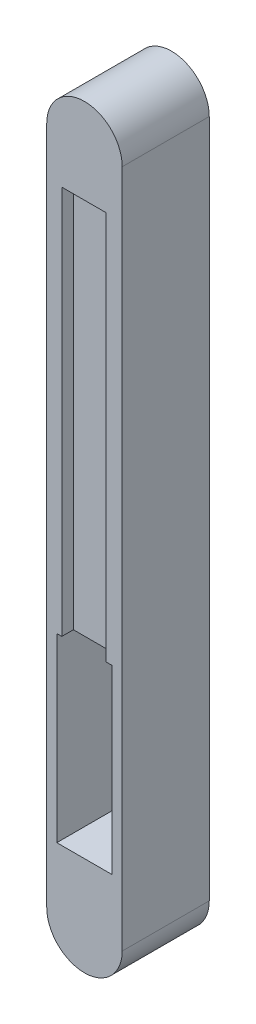
from build123d import *

# Parameters (mm, degrees)
BOSS_EXTRUDE1_DEPTH = 135
SKETCH3_R           = 3.5
CUT_EXTRUDE2_DEPTH  = 10
SKETCH6_W           = 11
SKETCH6_H           = 36
CUT_EXTRUDE3_DEPTH  = 40
SKETCH7_W           = 55
SKETCH7_H           = 16.435142828
BOSS_EXTRUDE2_DEPTH = 35
CUT_EXTRUDE4_DEPTH  = 20
CUT_EXTRUDE5_DEPTH  = 20
SKETCH12_R          = 4.5
CUT_EXTRUDE6_DEPTH  = 20
CUT_EXTRUDE7_DEPTH  = 120
SKETCH14_W          = 10
SKETCH14_H          = 112.990035736
BOSS_EXTRUDE3_DEPTH = 9
SKETCH16_W          = 117.700647477
SKETCH16_H          = 151.246123551
CUT_EXTRUDE11_DEPTH = 166.309899973


with BuildPart() as part:
    # Sketch2 → Boss-Extrude1 (new body)
    with BuildSketch(Plane.XY):
        with BuildLine():
            Line((-7.403081865, 56.261800555), (-7.403081865, -78.738199445))
            ThreePointArc((-7.403081865, -78.738199445), (0.096918135, -86.238199445), (7.596918135, -78.738199445))
            Line((7.596918135, -78.738199445), (7.596918135, 56.261800555))
            ThreePointArc((7.596918135, 56.261800555), (0.096918135, 63.761800555), (-7.403081865, 56.261800555))
        make_face()
    extrude(amount=BOSS_EXTRUDE1_DEPTH)

    # Sketch3 → Cut-Extrude2 (cut)
    with BuildSketch(Plane(origin=(0, 0, 0), x_dir=(-1, 0, 0), z_dir=(0, 0, -1))):
        with Locations((-0.096918135, 54.761800555)):
            Circle(SKETCH3_R)
    extrude(amount=-CUT_EXTRUDE2_DEPTH, mode=Mode.SUBTRACT)

    # Sketch6 → Cut-Extrude3 (cut)
    with BuildSketch(Plane(origin=(0, 0, 0), x_dir=(-1, 0, 0), z_dir=(0, 0, -1))):
        with Locations((-0.096918135, -48.578199445)):
            Rectangle(SKETCH6_W, SKETCH6_H)
    extrude(amount=-CUT_EXTRUDE3_DEPTH, mode=Mode.SUBTRACT)

    # Sketch7 → Boss-Extrude2 (add)
    with BuildSketch(Plane.ZY.offset(7.403081865)):
        with Locations((67.5, -49.750557846)):
            Rectangle(SKETCH7_W, SKETCH7_H)
    extrude(amount=BOSS_EXTRUDE2_DEPTH)

    # Sketch10 → Cut-Extrude4 (cut)
    with BuildSketch(Plane(origin=(0, -41.532986432, 0), x_dir=(1, 0, 0), z_dir=(0, 1, 0))):
        with BuildLine():
            Line((-7.403081865, -40), (-42.403081865, -40))
            Line((-42.403081865, -40), (-42.403081865, -95))
            Line((-42.403081865, -95), (-7.403081865, -95))
            ThreePointArc((-7.403081865, -95), (-33.21161021, -67.5), (-7.403081865, -40))
        make_face()
    extrude(amount=-CUT_EXTRUDE4_DEPTH, mode=Mode.SUBTRACT)

    # Sketch11 → Cut-Extrude5 (cut)
    with BuildSketch(Plane(origin=(0, -41.532986432, 0), x_dir=(1, 0, 0), z_dir=(0, 1, 0))):
        with BuildLine():
            Line((-7.569996139, -52.041059143), (-7.569996139, -82.958940857))
            ThreePointArc((-7.569996139, -82.958940857), (-23.028936996, -67.5), (-7.569996139, -52.041059143))
        make_face()
    extrude(amount=-CUT_EXTRUDE5_DEPTH, mode=Mode.SUBTRACT)

    # Sketch12 → Cut-Extrude6 (cut)
    with BuildSketch(Plane.XY.offset(135)):
        with Locations((0.096918135, 54.761800555)):
            Circle(SKETCH12_R)
    extrude(amount=-CUT_EXTRUDE6_DEPTH, mode=Mode.SUBTRACT)

    # Sketch13 → Cut-Extrude7 (cut)
    with BuildSketch(Plane.XY.offset(135)):
        Polygon((4.403081865, 46.751836291), (-4.403081865, 46.751836291), (-4.403081865, -46.751836291), (-4.403081865, -66.238199445), (4.403081865, -66.238199445), (4.403081865, -46.751836291), align=None)
    extrude(amount=-CUT_EXTRUDE7_DEPTH, mode=Mode.SUBTRACT)

    # Sketch14 → Boss-Extrude3 (add)
    with BuildSketch(Plane.ZY.offset(-4.403081865)):
        with Locations((130, -9.743181577)):
            Rectangle(SKETCH14_W, SKETCH14_H)
    extrude(amount=BOSS_EXTRUDE3_DEPTH)

    # Sketch16 → Cut-Extrude11 (cut, through all)
    with BuildSketch(Plane(origin=(7.596918135, 0, 0), x_dir=(0, 0, -1), z_dir=(1, 0, 0))):
        with Locations((-76.149676262, -11.861261221)):
            Rectangle(SKETCH16_W, SKETCH16_H)
    extrude(amount=-CUT_EXTRUDE11_DEPTH, mode=Mode.SUBTRACT)


solid = part.part
